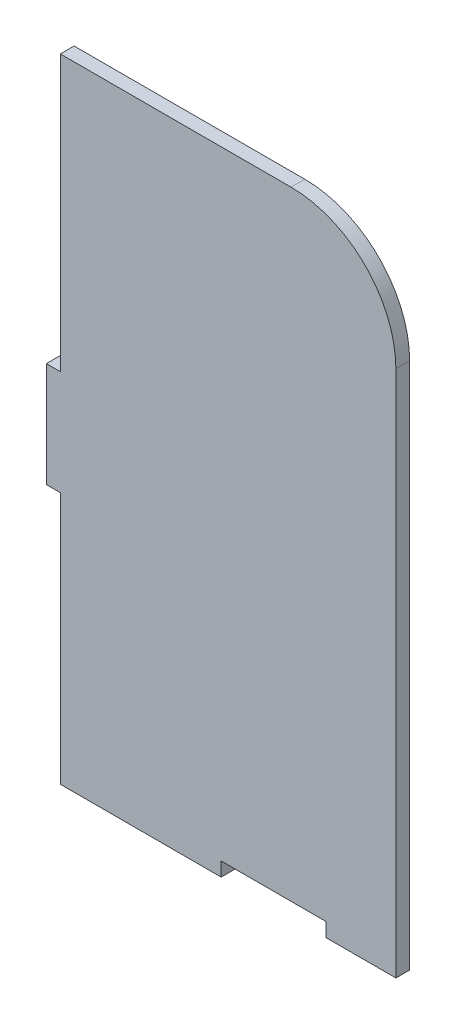
from build123d import *

# Parameters (mm, degrees)
BOSS_EXTRUDE1_DEPTH = 10


with BuildPart() as part:
    # Sketch1 → Boss-Extrude1 (new body)
    with BuildSketch(Plane.XY):
        with BuildLine():
            Line((215.829586762, -10.16), (383.521789204, -10.16))
            ThreePointArc((383.521789204, -10.16), (437.403325931, -32.478463274), (459.721789204, -86.36))
            Line((459.721789204, -86.36), (459.721789204, -469.9))
            Line((459.721789204, -469.9), (408.921789204, -469.9))
            Line((408.921789204, -469.9), (408.921789204, -459.74))
            Line((408.921789204, -459.74), (332.721789204, -459.74))
            Line((332.721789204, -459.74), (332.721789204, -469.9))
            Line((332.721789204, -469.9), (215.829586762, -469.9))
            Line((215.829586762, -469.9), (215.829586762, -286.36))
            Line((215.829586762, -286.36), (205.663096361, -286.36))
            Line((205.663096361, -286.36), (205.663096361, -210.16))
            Line((205.663096361, -210.16), (215.829586762, -210.16))
            Line((215.829586762, -210.16), (215.829586762, -10.16))
        make_face()
    extrude(amount=-BOSS_EXTRUDE1_DEPTH)


solid = part.part
